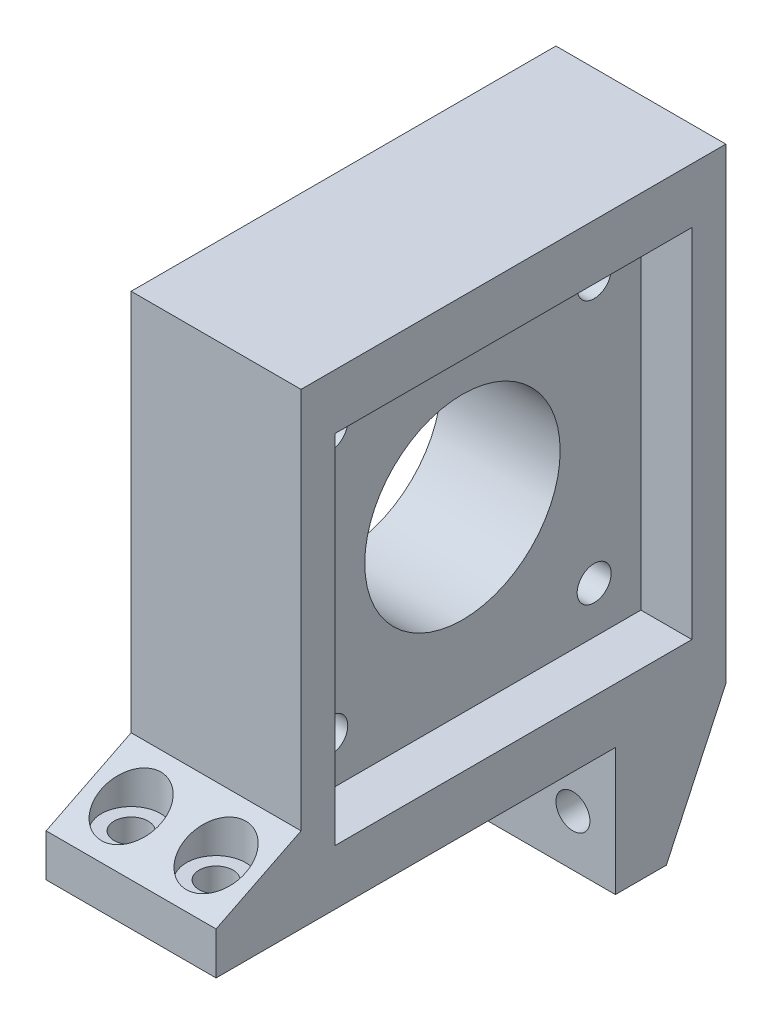
from build123d import *

# Parameters (mm, degrees)
SKETCH1_W           = 20
SKETCH1_H           = 50
BOSS_EXTRUDE1_DEPTH = 70
SKETCH2_R           = 2
SKETCH2_R_2         = 11.5
CUT_EXTRUDE2_DEPTH  = 60
SKETCH4_W           = 37
SKETCH4_H           = 15
CUT_EXTRUDE3_DEPTH  = 60
SKETCH8_R           = 2
CUT_EXTRUDE5_DEPTH  = 15
SKETCH9_W           = 42
SKETCH9_H           = 42
CUT_EXTRUDE6_DEPTH  = 6
CUT_EXTRUDE8_DEPTH  = 30
SKETCH12_W          = 20
SKETCH12_H          = 5
BOSS_EXTRUDE2_DEPTH = 10
BOSS_EXTRUDE3_DEPTH = 20
SKETCH15_R          = 2
CUT_EXTRUDE9_DEPTH  = 10
SKETCH17_R          = 3.5
CUT_EXTRUDE11_DEPTH = 8
SKETCH18_R          = 3.5
CUT_EXTRUDE12_DEPTH = 50


with BuildPart() as part:
    # Sketch1 → Boss-Extrude1 (new body)
    with BuildSketch(Plane(origin=(0, 0, 0), x_dir=(1, 0, 0), z_dir=(0, 1, 0))):
        with Locations((-10, -25)):
            Rectangle(SKETCH1_W, SKETCH1_H)
    extrude(amount=BOSS_EXTRUDE1_DEPTH)

    # Sketch2 → Cut-Extrude2 (cut)
    with BuildSketch(Plane(origin=(0, 0, 0), x_dir=(0, 0, -1), z_dir=(1, 0, 0))):
        with Locations((-9.5, 58)):
            Circle(SKETCH2_R)
        with Locations((-25, 42.5)):
            Circle(SKETCH2_R_2)
        with Locations((-9.5, 27)):
            Circle(SKETCH2_R)
        with Locations((-40.5, 27)):
            Circle(SKETCH2_R)
        with Locations((-40.5, 58)):
            Circle(SKETCH2_R)
    extrude(amount=-CUT_EXTRUDE2_DEPTH, mode=Mode.SUBTRACT)

    # Sketch4 → Cut-Extrude3 (cut)
    with BuildSketch(Plane(origin=(0, 0, 0), x_dir=(0, 0, -1), z_dir=(1, 0, 0))):
        with Locations((-31.5, 7.5)):
            Rectangle(SKETCH4_W, SKETCH4_H)
    extrude(amount=-CUT_EXTRUDE3_DEPTH, mode=Mode.SUBTRACT)

    # Sketch8 → Cut-Extrude5 (cut)
    with BuildSketch(Plane(origin=(0, 0, 0), x_dir=(-1, 0, 0), z_dir=(0, 0, -1))):
        with Locations((15, 6)):
            Circle(SKETCH8_R)
        with Locations((5, 6)):
            Circle(SKETCH8_R)
    extrude(amount=-CUT_EXTRUDE5_DEPTH, mode=Mode.SUBTRACT)

    # Sketch9 → Cut-Extrude6 (cut)
    with BuildSketch(Plane(origin=(0, 0, 0), x_dir=(0, 0, -1), z_dir=(1, 0, 0))):
        with Locations((-25, 42.5)):
            Rectangle(SKETCH9_W, SKETCH9_H)
    extrude(amount=-CUT_EXTRUDE6_DEPTH, mode=Mode.SUBTRACT)

    # Sketch11 → Cut-Extrude8 (cut)
    with BuildSketch(Plane(origin=(0, 0, 0), x_dir=(0, 0, -1), z_dir=(1, 0, 0))):
        Polygon((-7, 0), (0, 0), (0, 15), align=None)
    extrude(amount=-CUT_EXTRUDE8_DEPTH, mode=Mode.SUBTRACT)

    # Sketch12 → Boss-Extrude2 (add)
    with BuildSketch(Plane.XY.offset(50)):
        with Locations((-10, 17.5)):
            Rectangle(SKETCH12_W, SKETCH12_H)
    extrude(amount=BOSS_EXTRUDE2_DEPTH)

    # Sketch14 → Boss-Extrude3 (add)
    with BuildSketch(Plane(origin=(0, 0, 0), x_dir=(0, 0, -1), z_dir=(1, 0, 0))):
        Polygon((-50, 20), (-60, 20), (-50, 25), align=None)
    extrude(amount=-BOSS_EXTRUDE3_DEPTH)

    # Sketch15 → Cut-Extrude9 (cut)
    with BuildSketch(Plane(origin=(0, 15, 0), x_dir=(-1, 0, 0), z_dir=(0, -1, 0))):
        with Locations(Location((5, -55, 0), (0, 0, 90))):
            Circle(SKETCH15_R)
        with Locations(Location((15, -55, 0), (0, 0, 90))):
            Circle(SKETCH15_R)
    extrude(amount=-CUT_EXTRUDE9_DEPTH, mode=Mode.SUBTRACT)

    # Sketch17 → Cut-Extrude11 (cut)
    with BuildSketch(Plane(origin=(0, 0, 0), x_dir=(-1, 0, 0), z_dir=(0, 0, -1))):
        with Locations((15, 6)):
            Circle(SKETCH17_R)
        with Locations((5, 6)):
            Circle(SKETCH17_R)
    extrude(amount=-CUT_EXTRUDE11_DEPTH, mode=Mode.SUBTRACT)

    # Sketch18 → Cut-Extrude12 (cut)
    with BuildSketch(Plane(origin=(0, 70, 0), x_dir=(1, 0, 0), z_dir=(0, 1, 0))):
        with Locations(Location((-15, -55, 0), (0, 0, 270))):
            Circle(SKETCH18_R)
        with Locations(Location((-5, -55, 0), (0, 0, 270))):
            Circle(SKETCH18_R)
    extrude(amount=-CUT_EXTRUDE12_DEPTH, mode=Mode.SUBTRACT)


solid = part.part
